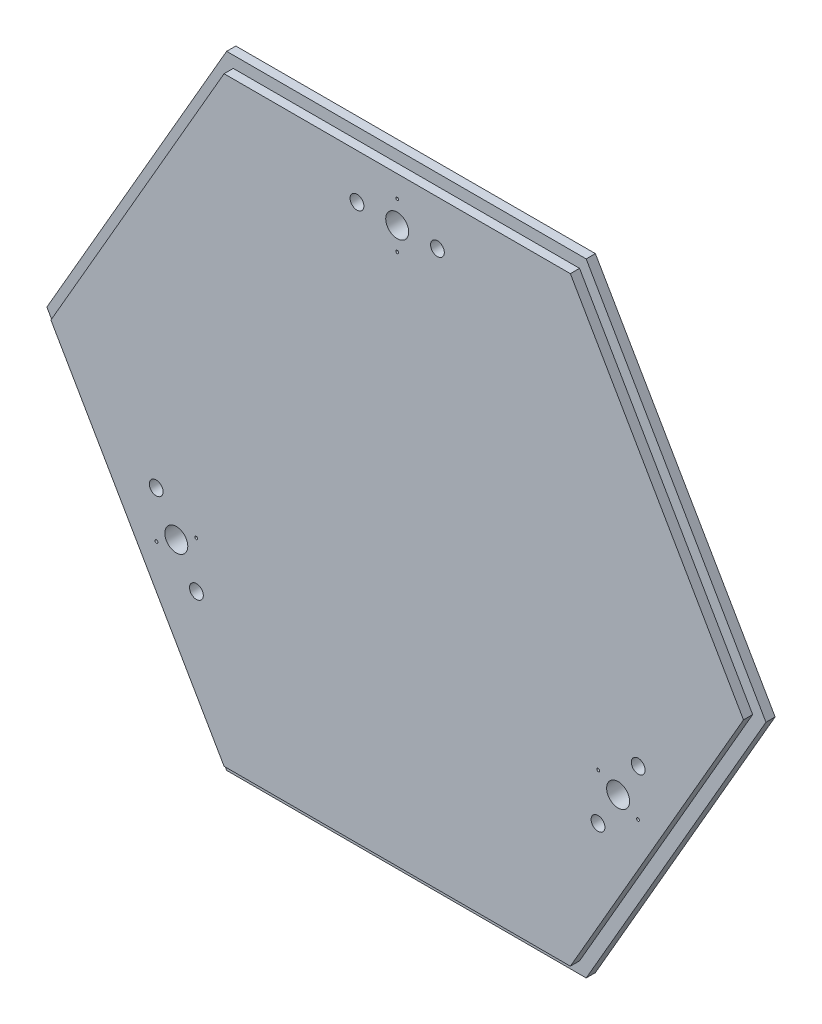
from build123d import *

# Parameters (mm, degrees)
BOSS_EXTRUDE1_DEPTH = 16
CUT_EXTRUDE1_REACH  = 426.953
SKETCH3_R           = 6
SKETCH4_OUTSIDE_W   = 813.904
SKETCH4_OUTSIDE_H   = 727.89
CUT_EXTRUDE2_DEPTH  = 8
SKETCH5_R           = 1.25
SKETCH5_R_2         = 10
CUT_EXTRUDE3_DEPTH  = 425.953330771
CUT_EXTRUDE6_DEPTH  = 425.953330771


with BuildPart() as part:
    # Sketch1 → Boss-Extrude1 (new body)
    with BuildSketch(Plane.XY):
        Polygon((160.503374835, 278), (-160.503374835, 278), (-321.006749669, 0), (-160.503374835, -278), (160.503374835, -278), (321.006749669, 0), align=None)
    extrude(amount=BOSS_EXTRUDE1_DEPTH)

    # Sketch3 → Cut-Extrude1 (cut, up to next)
    with BuildSketch(Plane.XY.offset(16), mode=Mode.PRIVATE) as cut_extrude1_sk1:
        with Locations((35, 222)):
            Circle(SKETCH3_R)
    cut_extrude1_tool1 = extrude(cut_extrude1_sk1.sketch, amount=-CUT_EXTRUDE1_REACH, mode=Mode.PRIVATE) & part.part
    # Sketch3 → Cut-Extrude1 (cut, up to next)
    with BuildSketch(Plane.XY.offset(16), mode=Mode.PRIVATE) as cut_extrude1_sk2:
        with Locations((-35, 222)):
            Circle(SKETCH3_R)
    cut_extrude1_tool2 = extrude(cut_extrude1_sk2.sketch, amount=-CUT_EXTRUDE1_REACH, mode=Mode.PRIVATE) & part.part
    # Sketch3 → Cut-Extrude1 (cut, up to next)
    with BuildSketch(Plane.XY.offset(16), mode=Mode.PRIVATE) as cut_extrude1_sk3:
        with Locations((-209.75763964, -80.689110868)):
            Circle(SKETCH3_R)
    cut_extrude1_tool3 = extrude(cut_extrude1_sk3.sketch, amount=-CUT_EXTRUDE1_REACH, mode=Mode.PRIVATE) & part.part
    # Sketch3 → Cut-Extrude1 (cut, up to next)
    with BuildSketch(Plane.XY.offset(16), mode=Mode.PRIVATE) as cut_extrude1_sk4:
        with Locations((-174.75763964, -141.310889132)):
            Circle(SKETCH3_R)
    cut_extrude1_tool4 = extrude(cut_extrude1_sk4.sketch, amount=-CUT_EXTRUDE1_REACH, mode=Mode.PRIVATE) & part.part
    # Sketch3 → Cut-Extrude1 (cut, up to next)
    with BuildSketch(Plane.XY.offset(16), mode=Mode.PRIVATE) as cut_extrude1_sk5:
        with Locations((174.75763964, -141.310889132)):
            Circle(SKETCH3_R)
    cut_extrude1_tool5 = extrude(cut_extrude1_sk5.sketch, amount=-CUT_EXTRUDE1_REACH, mode=Mode.PRIVATE) & part.part
    # Sketch3 → Cut-Extrude1 (cut, up to next)
    with BuildSketch(Plane.XY.offset(16), mode=Mode.PRIVATE) as cut_extrude1_sk6:
        with Locations((209.75763964, -80.689110868)):
            Circle(SKETCH3_R)
    cut_extrude1_tool6 = extrude(cut_extrude1_sk6.sketch, amount=-CUT_EXTRUDE1_REACH, mode=Mode.PRIVATE) & part.part
    add(cut_extrude1_tool1.solids().sort_by_distance((35, 222, 16))[0], mode=Mode.SUBTRACT)
    add(cut_extrude1_tool2.solids().sort_by_distance((-35, 222, 16))[0], mode=Mode.SUBTRACT)
    add(cut_extrude1_tool3.solids().sort_by_distance((-209.75764, -80.689111, 16))[0], mode=Mode.SUBTRACT)
    add(cut_extrude1_tool4.solids().sort_by_distance((-174.75764, -141.310889, 16))[0], mode=Mode.SUBTRACT)
    add(cut_extrude1_tool5.solids().sort_by_distance((174.75764, -141.310889, 16))[0], mode=Mode.SUBTRACT)
    add(cut_extrude1_tool6.solids().sort_by_distance((209.75764, -80.689111, 16))[0], mode=Mode.SUBTRACT)

    # Sketch4 outside → Cut-Extrude2 (cut)
    with BuildSketch(Plane.XY.offset(16)):
        Rectangle(SKETCH4_OUTSIDE_W, SKETCH4_OUTSIDE_H)
        Polygon((301.376840517, 0), (150.688420258, 261), (-150.688420258, 261), (-301.376840517, 0), (-150.688420258, -261), (150.688420258, -261), align=None, mode=Mode.SUBTRACT)
    extrude(amount=-CUT_EXTRUDE2_DEPTH, mode=Mode.SUBTRACT)

    # Sketch5 → Cut-Extrude3 (cut, through all)
    with BuildSketch(Plane.XY.offset(16)):
        with Locations((209.578147716, -121)):
            Circle(SKETCH5_R)
        with Locations((174.937131564, -101)):
            Circle(SKETCH5_R)
        with Locations((-192.25763964, -111)):
            Circle(SKETCH5_R_2)
        with Locations((0, 222)):
            Circle(SKETCH5_R_2)
        with Locations((-209.578147716, -121)):
            Circle(SKETCH5_R)
        with Locations((-174.937131564, -101)):
            Circle(SKETCH5_R)
        with Locations((0, 242)):
            Circle(SKETCH5_R)
        with Locations((0, 202)):
            Circle(SKETCH5_R)
        with Locations((192.25763964, -111)):
            Circle(SKETCH5_R_2)
    extrude(amount=-CUT_EXTRUDE3_DEPTH, mode=Mode.SUBTRACT)

    # Sketch8 → Cut-Extrude6 (cut, through all)
    with BuildSketch(Plane(origin=(0, 0, 0), x_dir=(-1, 0, 0), z_dir=(0, 0, -1))):
        Polygon((160.503374835, 278), (-160.503374835, 278), (-321.006749669, 0), (-160.503374835, -278), (160.503374835, -278), (321.006749669, 0), align=None)
        Polygon((156.46192295, 271), (-156.46192295, 271), (-312.923845901, 0), (-156.46192295, -271), (156.46192295, -271), (312.923845901, 0), align=None, mode=Mode.SUBTRACT)
    extrude(amount=-CUT_EXTRUDE6_DEPTH, mode=Mode.SUBTRACT)


solid = part.part
